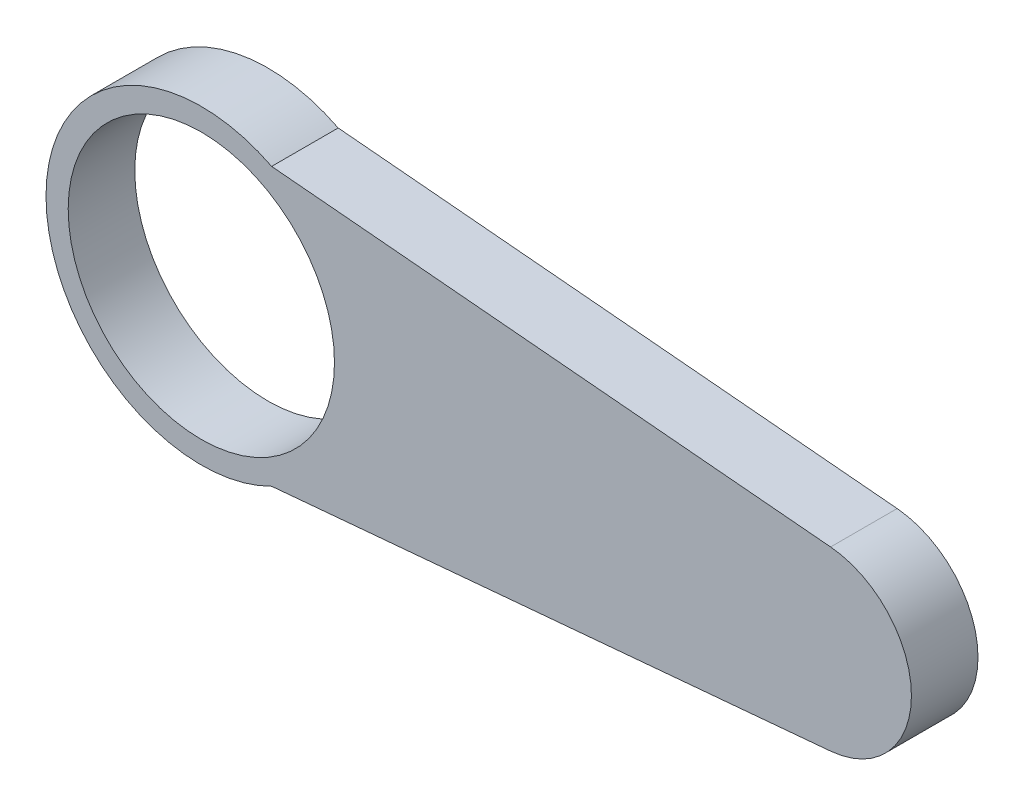
from build123d import *

# Parameters (mm, degrees)
SKETCH1_R           = 3
BOSS_EXTRUDE1_DEPTH = 1.5


with BuildPart() as part:
    # Sketch1 → Boss-Extrude1 (new body)
    with BuildSketch(Plane.XY):
        with BuildLine():
            Line((1.58402839, 3.121034133), (14.178571429, 1.99201211))
            ThreePointArc((14.178571429, 1.99201211), (16, 0), (14.178571429, -1.99201211))
            Line((14.178571429, -1.99201211), (1.58402839, -3.121034133))
            ThreePointArc((1.58402839, -3.121034133), (-3.5, 0), (1.58402839, 3.121034133))
        make_face()
        Circle(SKETCH1_R, mode=Mode.SUBTRACT)
    extrude(amount=BOSS_EXTRUDE1_DEPTH)


solid = part.part
